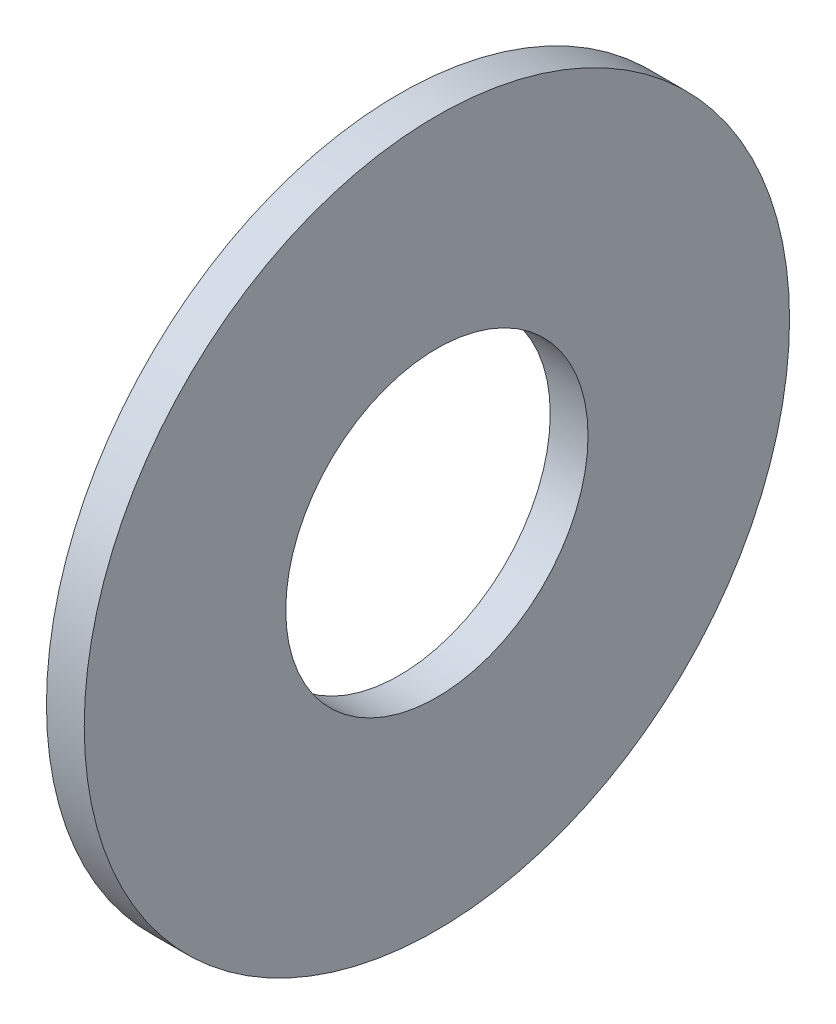
from build123d import *

# Parameters (mm, degrees)
SKETCH1_R           = 7
SKETCH1_R_2         = 3
BOSS_EXTRUDE1_DEPTH = 0.75


with BuildPart() as part:
    # Sketch1 → Boss-Extrude1 (new body)
    with BuildSketch(Plane(origin=(0, 0, 0), x_dir=(0, 0, -1), z_dir=(1, 0, 0))):
        Circle(SKETCH1_R)
        Circle(SKETCH1_R_2, mode=Mode.SUBTRACT)
    extrude(amount=BOSS_EXTRUDE1_DEPTH)


solid = part.part
